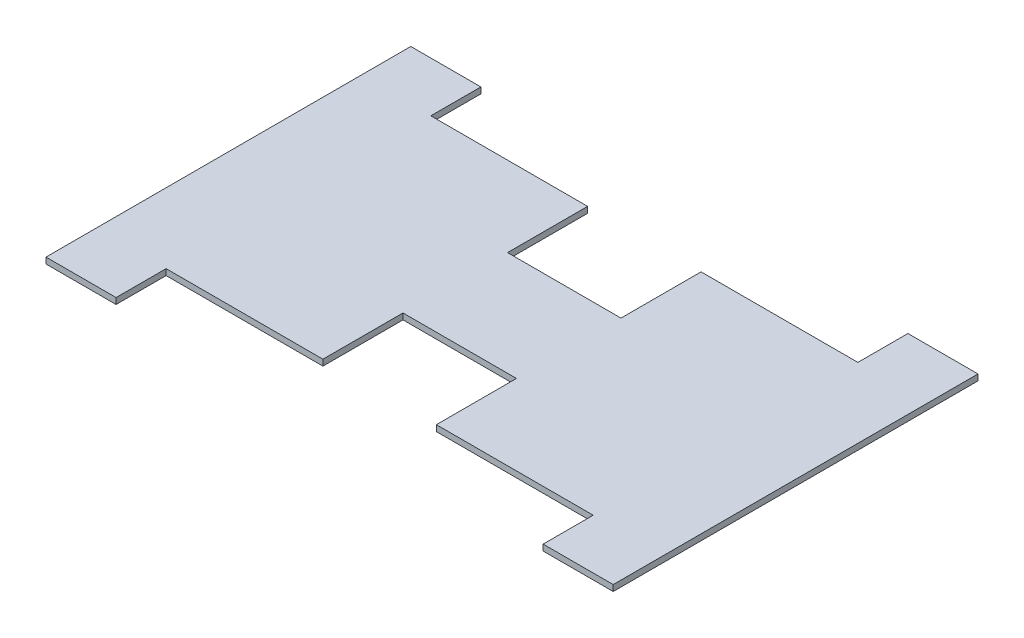
from build123d import *

# Parameters (mm, degrees)
BOSS_EXTRUDE1_DEPTH = 8.636


with BuildPart() as part:
    # Sketch1 → Boss-Extrude1 (new body)
    with BuildSketch(Plane(origin=(0, 0, 0), x_dir=(1, 0, 0), z_dir=(0, 1, 0))):
        Polygon((-304.8, 260.35), (-304.8, 188.9125), (-80.9625, 188.9125), (-80.9625, 74.6125), (80.9625, 74.6125), (80.9625, 188.9125), (304.8, 188.9125), (304.8, 260.35), (404.8125, 260.35), (404.8125, -260.35), (304.8, -260.35), (304.8, -188.9125), (80.9625, -188.9125), (80.9625, -74.6125), (-80.9625, -74.6125), (-80.9625, -188.9125), (-304.8, -188.9125), (-304.8, -260.35), (-404.8125, -260.35), (-404.8125, 260.35), align=None)
    extrude(amount=BOSS_EXTRUDE1_DEPTH)


solid = part.part
